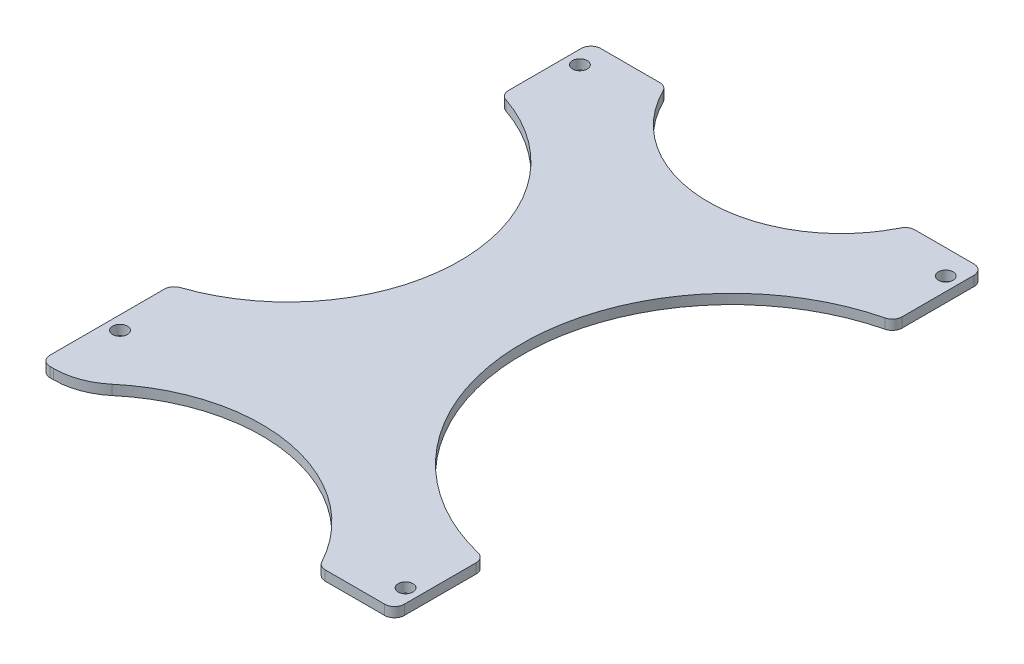
from build123d import *

# Parameters (mm, degrees)
SKETCH1_W           = 80
SKETCH1_H           = 120
BOSS_EXTRUDE1_DEPTH = 2
SKETCH2_R           = 1.5
CUT_EXTRUDE1_DEPTH  = 145.235917857
CUT_EXTRUDE2_DEPTH  = 145.235917857
FILLET1_R           = 2


with BuildPart() as part:
    # Sketch1 → Boss-Extrude1 (new body)
    with BuildSketch(Plane(origin=(0, 0, 0), x_dir=(1, 0, 0), z_dir=(0, 1, 0))):
        with Locations((40, 60)):
            Rectangle(SKETCH1_W, SKETCH1_H)
    extrude(amount=BOSS_EXTRUDE1_DEPTH)

    # Sketch2 → Cut-Extrude1 (cut, through all)
    with BuildSketch(Plane(origin=(0, 2, 0), x_dir=(1, 0, 0), z_dir=(0, 1, 0))):
        with Locations(Location((2.75, 115, 0), (0, 0, 270))):
            Circle(SKETCH2_R)
        with Locations(Location((77.25, 115, 0), (0, 0, 90))):
            Circle(SKETCH2_R)
        with Locations(Location((77.25, 5, 0), (0, 0, 270))):
            Circle(SKETCH2_R)
        with Locations(Location((2.75, 21.35, 0), (0, 0, 270))):
            Circle(SKETCH2_R)
    extrude(amount=-CUT_EXTRUDE1_DEPTH, mode=Mode.SUBTRACT)

    # Sketch3 → Cut-Extrude2 (cut, through all)
    with BuildSketch(Plane(origin=(0, 2, 0), x_dir=(1, 0, 0), z_dir=(0, 1, 0))):
        with BuildLine():
            Line((2.75, 128.5), (77.25, 128.5))
            ThreePointArc((77.25, 128.5), (69.809659383, 126.264605253), (64.833333333, 120.298715777))
            ThreePointArc((64.833333333, 120.298715777), (40, 103.896147332), (15.166666667, 120.298715777))
            ThreePointArc((15.166666667, 120.298715777), (10.190340617, 126.264605253), (2.75, 128.5))
        make_face()
        with BuildLine():
            Line((-10.75, 115), (-10.75, 21.35))
            ThreePointArc((-10.75, 21.35), (-7.967575093, 29.558750461), (-0.767246795, 34.383762887))
            ThreePointArc((-0.767246795, 34.383762887), (25.113965218, 68.175), (-0.767246795, 101.966237113))
            ThreePointArc((-0.767246795, 101.966237113), (-7.967575093, 106.791249539), (-10.75, 115))
        make_face()
        with BuildLine():
            Line((-10.75, 7.85), (-10.75, -8.5))
            Line((-10.75, -8.5), (77.25, -8.5))
            ThreePointArc((77.25, -8.5), (69.997734791, -6.386599551), (65.016127441, -0.708096198))
            ThreePointArc((65.016127441, -0.708096198), (41.147259356, 18.402573211), (11.469252441, 11.043466302))
            ThreePointArc((11.469252441, 11.043466302), (7.392832922, 8.673482242), (2.75, 7.85))
            Line((2.75, 7.85), (-10.75, 7.85))
        make_face()
        with BuildLine():
            Line((90.75, 5), (90.75, 115))
            ThreePointArc((90.75, 115), (87.723180033, 106.481637481), (80, 101.783060112))
            ThreePointArc((80, 101.783060112), (46.015741918, 60), (80, 18.216939888))
            ThreePointArc((80, 18.216939888), (87.723180033, 13.518362519), (90.75, 5))
        make_face()
    extrude(amount=-CUT_EXTRUDE2_DEPTH, mode=Mode.SUBTRACT)

    # Fillet1
    fillet1_edges = [part.edges().sort_by_distance(p)[0] for p in [
        (0, 1, -101.749786914),
        (0, 1, -34.600213086),
        (64.675872748, 1, 0),
        (0, 1, -7.85),
        (80, 1, -18.216939888),
        (80, 1, -101.783060112),
        (0, 1, -120),
        (80, 1, -120),
        (64.703723876, 1, -120),
        (80, 1, 0),
        (15.296276124, 1, -120),
    ]]
    fillet(fillet1_edges, radius=FILLET1_R)


solid = part.part
